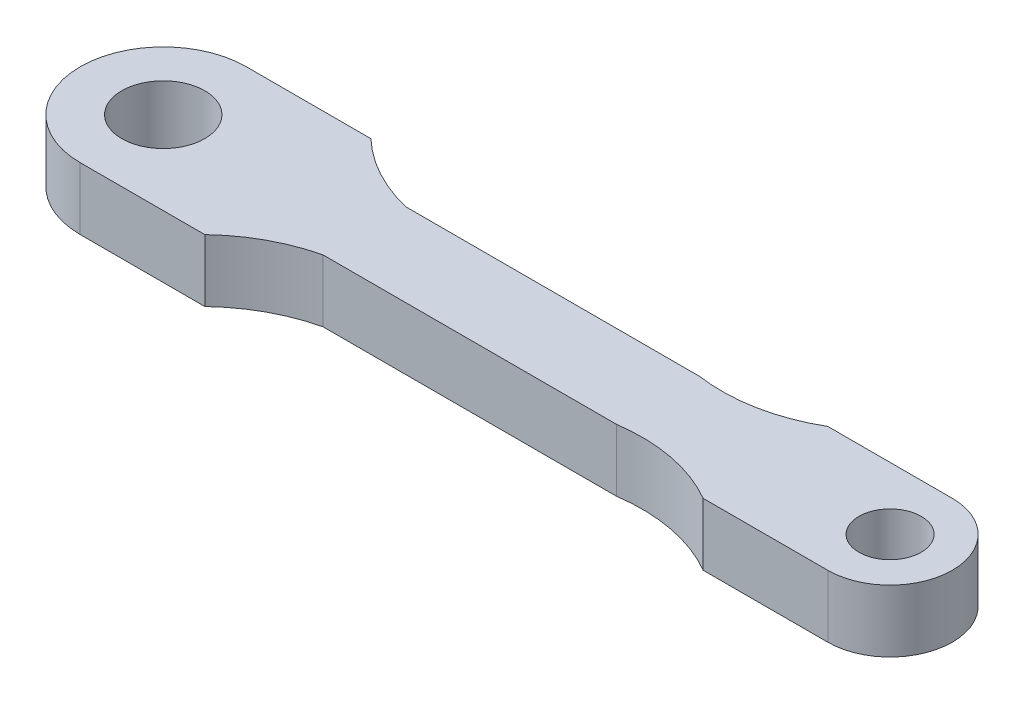
from build123d import *

# Parameters (mm, degrees)
SKETCH1_R           = 1.5
SKETCH1_R_2         = 2
BOSS_EXTRUDE1_DEPTH = 1.5


with BuildPart() as part:
    # Sketch1 → Boss-Extrude1 (new, symmetric)
    with BuildSketch(Plane(origin=(0, 0, 0), x_dir=(1, 0, 0), z_dir=(0, 1, 0))):
        with BuildLine():
            Line((-17.5, 4), (-11.5, 4))
            ThreePointArc((-11.5, 4), (-9.787250471, 2.753376432), (-7.807350165, 2))
            Line((-7.807350165, 2), (6.326731681, 2))
            ThreePointArc((6.326731681, 2), (8.998056486, 2.061872567), (11.5, 3))
            Line((11.5, 3), (17.5, 3))
            ThreePointArc((17.5, 3), (20.5, 0), (17.5, -3))
            Line((17.5, -3), (11.5, -3))
            ThreePointArc((11.5, -3), (8.998056486, -2.061872567), (6.326731681, -2))
            Line((6.326731681, -2), (-7.807350165, -2))
            ThreePointArc((-7.807350165, -2), (-9.787250471, -2.753376432), (-11.5, -4))
            Line((-11.5, -4), (-17.5, -4))
            ThreePointArc((-17.5, -4), (-21.5, 0), (-17.5, 4))
        make_face()
        with Locations(Location((17.5, 0, 0), (0, 0, 270))):
            Circle(SKETCH1_R, mode=Mode.SUBTRACT)
        with Locations(Location((-17.5, 0, 0), (0, 0, 270))):
            Circle(SKETCH1_R_2, mode=Mode.SUBTRACT)
    extrude(amount=BOSS_EXTRUDE1_DEPTH, both=True)


solid = part.part
